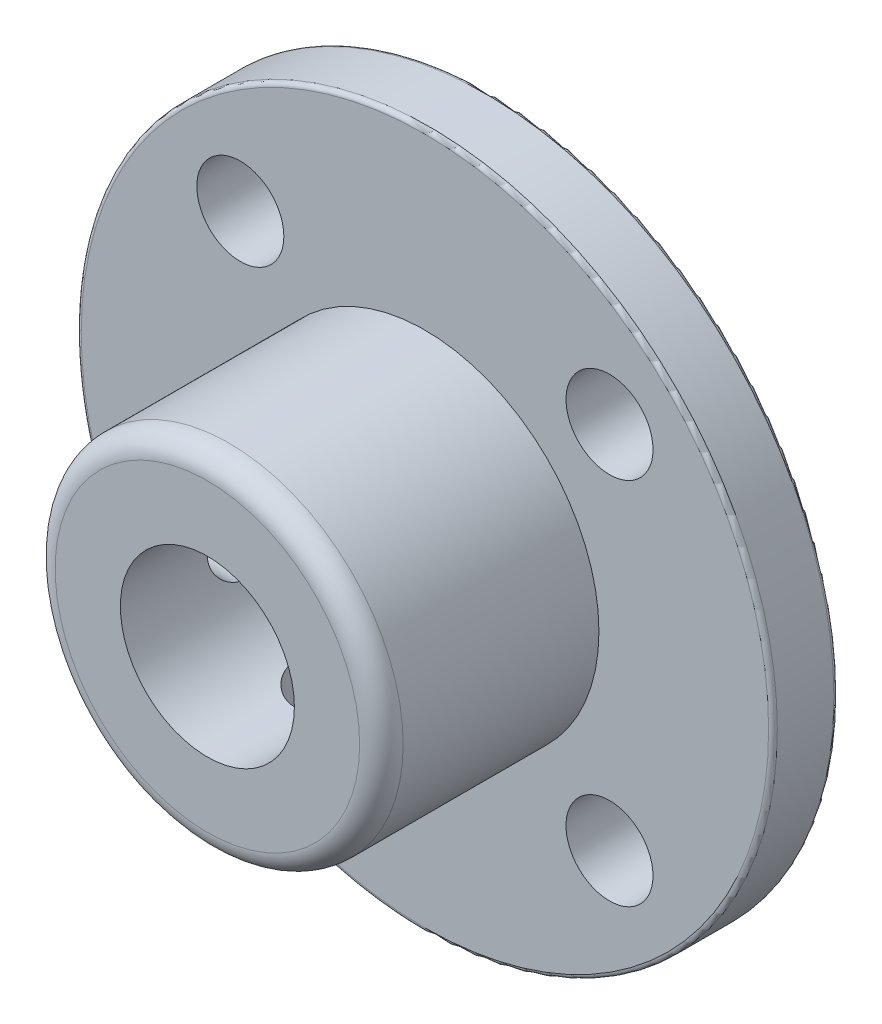
from build123d import *

# Parameters (mm, degrees)
SKETCH1_R           = 16
BOSS_EXTRUDE1_DEPTH = 3
SKETCH2_R           = 8
BOSS_EXTRUDE2_DEPTH = 10
SKETCH3_R           = 4
CUT_EXTRUDE1_DEPTH  = 27.095976701
SKETCH4_R           = 2
CUT_EXTRUDE2_DEPTH  = 25.738633754
FILLET1_R           = 1
SKETCH5_R           = 1.5
CUT_EXTRUDE3_DEPTH  = 9
SKETCH6_R           = 1.5
CUT_EXTRUDE4_DEPTH  = 9
FILLET2_R           = 0.2


with BuildPart() as part:
    # Sketch1 → Boss-Extrude1 (new body)
    with BuildSketch(Plane.XY):
        Circle(SKETCH1_R)
    extrude(amount=BOSS_EXTRUDE1_DEPTH)

    # Sketch2 → Boss-Extrude2 (add)
    with BuildSketch(Plane.XY.offset(3)):
        Circle(SKETCH2_R)
    extrude(amount=BOSS_EXTRUDE2_DEPTH)

    # Sketch3 → Cut-Extrude1 (cut, through all)
    with BuildSketch(Plane.XY.offset(13)):
        Circle(SKETCH3_R)
    extrude(amount=-CUT_EXTRUDE1_DEPTH, mode=Mode.SUBTRACT)

    # Sketch4 → Cut-Extrude2 (cut, through all)
    with BuildSketch(Plane.XY.offset(3)):
        with Locations((-8.485281374, 8.485281374)):
            Circle(SKETCH4_R)
        with Locations((8.485281374, 8.485281374)):
            Circle(SKETCH4_R)
        with Locations((8.485281374, -8.485281374)):
            Circle(SKETCH4_R)
        with Locations((-8.485281374, -8.485281374)):
            Circle(SKETCH4_R)
    extrude(amount=-CUT_EXTRUDE2_DEPTH, mode=Mode.SUBTRACT)

    # Fillet1
    fillet1_edges = [part.edges().sort_by_distance(p)[0] for p in [
        (-8, 0, 13),
    ]]
    fillet(fillet1_edges, radius=FILLET1_R)

    # Sketch5 → Cut-Extrude3 (cut)
    with BuildSketch(Plane(origin=(0, 0, 0), x_dir=(0, 0, -1), z_dir=(1, 0, 0))):
        with Locations((-7.5, 0)):
            Circle(SKETCH5_R)
    extrude(amount=-CUT_EXTRUDE3_DEPTH, mode=Mode.SUBTRACT)

    # Sketch6 → Cut-Extrude4 (cut)
    with BuildSketch(Plane(origin=(0, 0, 0), x_dir=(1, 0, 0), z_dir=(0, 1, 0))):
        with Locations(Location((0, -7.5, 0), (0, 0, 270))):
            Circle(SKETCH6_R)
    extrude(amount=-CUT_EXTRUDE4_DEPTH, mode=Mode.SUBTRACT)

    # Fillet2
    fillet2_edges = [part.edges().sort_by_distance(p)[0] for p in [
        (-16, 0, 0),
        (-16, 0, 3),
    ]]
    fillet(fillet2_edges, radius=FILLET2_R)


solid = part.part
